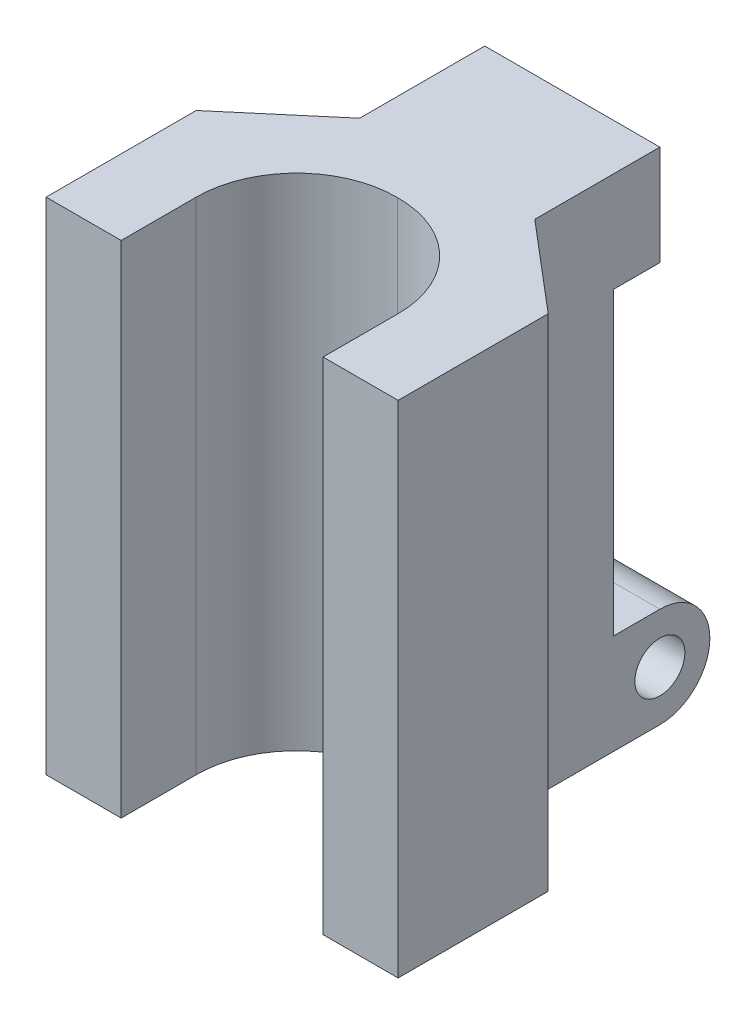
from build123d import *

# Parameters (mm, degrees)
BOSS_EXTRUDE1_DEPTH = 127
SKETCH2_R           = 6.35
BOSS_EXTRUDE3_DEPTH = 44.45


with BuildPart() as part:
    # Sketch1 → Boss-Extrude1 (new body)
    with BuildSketch(Plane(origin=(0, 0, 0), x_dir=(1, 0, 0), z_dir=(0, 1, 0))):
        with BuildLine():
            ThreePointArc((25.626778658, -38.1), (18.122521252, -20.031067918), (0, -12.657167374))
            ThreePointArc((0, -12.657167374), (-18.122521252, -20.031067918), (-25.626778658, -38.1))
            Line((-25.626778658, -38.1), (-25.626778658, -57.15))
            Line((-25.626778658, -57.15), (-44.676778658, -57.15))
            Line((-44.676778658, -57.15), (-44.676778658, -19.05))
            Line((-44.676778658, -19.05), (-22.225, 0))
            Line((-22.225, 0), (22.225, 0))
            Line((22.225, 0), (44.676778658, -19.05))
            Line((44.676778658, -19.05), (44.676778658, -57.15))
            Line((44.676778658, -57.15), (25.626778658, -57.15))
            Line((25.626778658, -57.15), (25.626778658, -38.1))
        make_face()
    extrude(amount=-BOSS_EXTRUDE1_DEPTH)

    # Sketch2 → Boss-Extrude3 (add)
    with BuildSketch(Plane(origin=(-22.225, 0, 0), x_dir=(0, 1, 0), z_dir=(-1, 0, 0))):
        with BuildLine():
            Line((-127, 0), (-127, 31.75))
            ThreePointArc((-127, 31.75), (-114.3, 44.45), (-101.6, 31.75))
            Line((-101.6, 31.75), (-101.6, 20.00617362))
            Line((-101.6, 20.00617362), (-25.4, 20.00617362))
            Line((-25.4, 20.00617362), (-25.4, 31.75))
            Line((-25.4, 31.75), (0, 31.75))
            Line((0, 31.75), (0, 0))
            Line((0, 0), (-127, 0))
        make_face()
        with Locations(Location((-114.3, 31.75, 0), (0, 0, 270))):
            Circle(SKETCH2_R, mode=Mode.SUBTRACT)
    extrude(amount=-BOSS_EXTRUDE3_DEPTH)


solid = part.part
